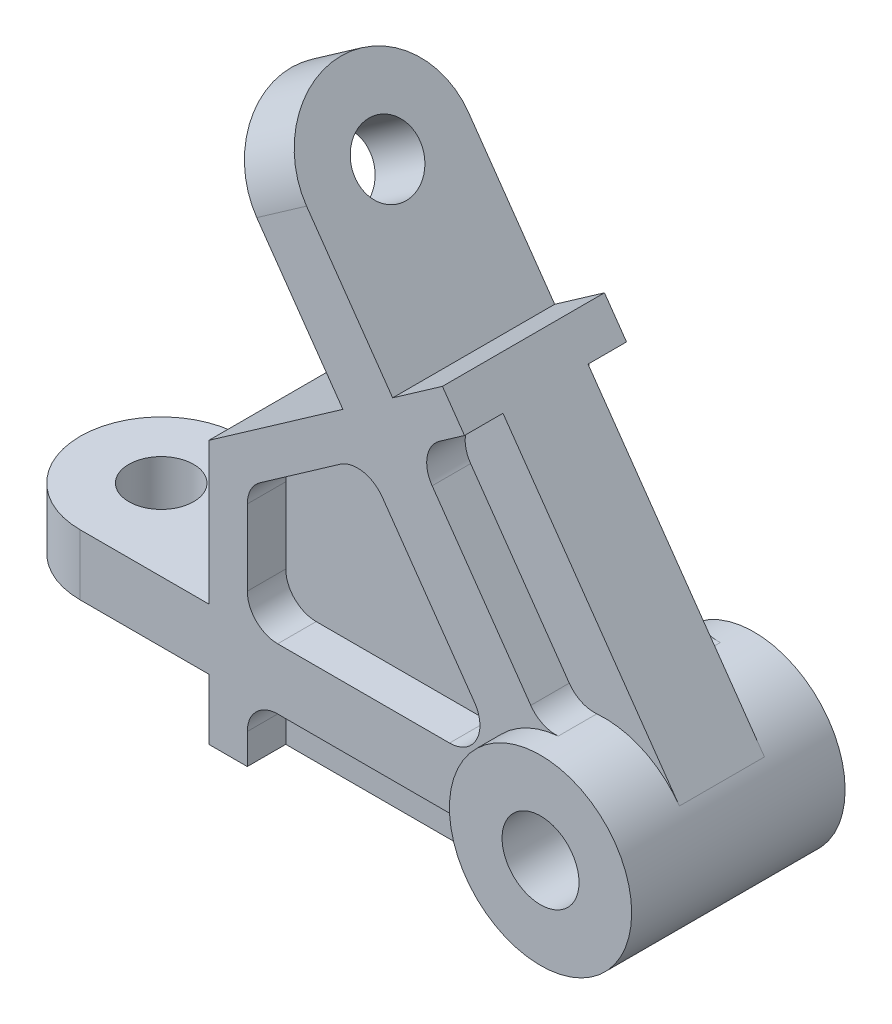
from build123d import *
from build123d.topology import SkipClean

# Parameters (mm, degrees)
BOSS_EXTRU_1_DEPTH      = 20
BOSS_EXTRU_2_DEPTH      = 26.35
BOSS_EXTRU_2_DEPTH_BACK = 26.35
ESQUISSE2_5_R           = 22.5
ESQUISSE2_5_R_2         = 9.5
BOSS_EXTRU_3_DEPTH      = 15
BOSS_EXTRU_4_DEPTH      = 15
ESQUISSE5_R             = 8
ENL_V_MAT_EXTRU_1_DEPTH = 189.886167776
ESQUISSE6_R             = 8
ENL_V_MAT_EXTRU_2_DEPTH = 192.871148908
ENL_V_START             = -9.5
ENL_V_MAT_EXTRU_3_DEPTH = 9.5


with BuildPart() as part:
    # Esquisse2 → Boss.-Extru.1 (new, symmetric)
    with BuildSketch(Plane.XY):
        with BuildLine():
            Line((-88.25, -22.5), (0, -22.5))
            ThreePointArc((0, -22.5), (-19.957743747, 10.389343798), (18.430920997, 12.905469818))
            Line((18.430920997, 12.905469818), (-30.570908371, 82.887334756))
            Line((-30.570908371, 82.887334756), (-42.858189035, 74.28368821))
            Line((-42.858189035, 74.28368821), (-64.119473121, 104.647948698))
            Line((-64.119473121, 104.647948698), (-76.406753785, 96.044302153))
            Line((-76.406753785, 96.044302153), (-55.1454697, 65.680041665))
            Line((-55.1454697, 65.680041665), (-88.25, 42.5))
            Line((-88.25, 42.5), (-88.25, 7.5))
            Line((-88.25, 7.5), (-120, 7.5))
            Line((-120, 7.5), (-120, -7.5))
            Line((-120, -7.5), (-88.25, -7.5))
            Line((-88.25, -7.5), (-88.25, -22.5))
        make_face()
    extrude(amount=BOSS_EXTRU_1_DEPTH, both=True)

    # Esquisse2<5> → Boss.-Extru.2 (add, two sides: drawn at the far end of the back side and taken through both)
    with BuildSketch(Plane.XY.offset(-BOSS_EXTRU_2_DEPTH_BACK)):
        Circle(ESQUISSE2_5_R)
        Circle(ESQUISSE2_5_R_2, mode=Mode.SUBTRACT)
    extrude(amount=BOSS_EXTRU_2_DEPTH + BOSS_EXTRU_2_DEPTH_BACK)

    # Esquisse3 → Boss.-Extru.3 (add)
    with BuildSketch(Plane.XZ.offset(7.5)):
        with BuildLine():
            Line((-120, 20), (-120, -20))
            ThreePointArc((-120, -20), (-140, 0), (-120, 20))
        make_face()
    extrude(amount=-BOSS_EXTRU_3_DEPTH)

    # Esquisse4 → Boss.-Extru.4 (add)
    with BuildSketch(Plane(origin=(6.143640332, 4.301823273, 0), x_dir=(0, 0, -1), z_dir=(0.819152044288993, 0.5735764363510446, 0))):
        with BuildLine():
            Line((-20, 122.5), (20, 122.5))
            ThreePointArc((20, 122.5), (0, 142.5), (-20, 122.5))
        make_face()
    extrude(amount=-BOSS_EXTRU_4_DEPTH)

    # Esquisse5 → Enlèv. mat.-Extru.1 (cut, through all)
    with BuildSketch(Plane(origin=(6.143640332, 4.301823273, 0), x_dir=(0, 0, -1), z_dir=(0.819152044288993, 0.5735764363510446, 0))):
        with Locations(Location((0, 122.5, 0), (0, 0, 90))):
            Circle(ESQUISSE5_R)
    extrude(amount=-ENL_V_MAT_EXTRU_1_DEPTH, mode=Mode.SUBTRACT)

    # Esquisse6 → Enlèv. mat.-Extru.2 (cut, through all)
    with BuildSketch(Plane.XZ.offset(7.5)):
        with Locations((-120, 0)):
            Circle(ESQUISSE6_R)
    extrude(amount=-ENL_V_MAT_EXTRU_2_DEPTH, mode=Mode.SUBTRACT)

    # Esquisse7 → Enlèv. mat.-Extru.3 (cut)
    with SkipClean():  # the faces are left unmerged after this step: merging them gives an invalid solid
        with BuildSketch(Plane.XY.offset(20).offset(ENL_V_START)):
            with BuildLine():
                Line((-31.265572558, 70.803567062), (-25.121932226, 75.105390335))
                Line((-25.121932226, 75.105390335), (18.430920997, 12.905469818))
                ThreePointArc((18.430920997, 12.905469818), (9.508910889, 20.391925208), (-1.961004212, 22.414380707))
                ThreePointArc((-1.961004212, 22.414380707), (-5.784309245, 23.08853254), (-8.758312615, 25.58401767))
                Line((-8.758312615, 25.58401767), (-33.107389617, 60.358103458))
                ThreePointArc((-33.107389617, 60.358103458), (-34.349807433, 65.962288063), (-31.265572558, 70.803567062))
            make_face()
            with BuildLine():
                Line((-75.551823273, 39.794000473), (-55.840133886, 53.596273972))
                ThreePointArc((-55.840133886, 53.596273972), (-50.235949281, 54.838691787), (-45.394670282, 51.754456912))
                Line((-45.394670282, 51.754456912), (-22.671091572, 19.301823273))
                ThreePointArc((-22.671091572, 19.301823273), (-22.162150656, 11.536885401), (-28.814731905, 7.5))
                Line((-28.814731905, 7.5), (-71.25, 7.5))
                ThreePointArc((-71.25, 7.5), (-76.553300859, 9.696699141), (-78.75, 15))
                Line((-78.75, 15), (-78.75, 33.650360141))
                ThreePointArc((-78.75, 33.650360141), (-77.902581249, 37.11347474), (-75.551823273, 39.794000473))
            make_face()
            with BuildLine():
                Line((-71.25, -7.5), (-25.980762114, -7.5))
                ThreePointArc((-25.980762114, -7.5), (-22.230762114, -8.504809472), (-19.485571585, -11.25))
                ThreePointArc((-19.485571585, -11.25), (-11.25, -19.485571585), (0, -22.5))
                Line((0, -22.5), (-78.75, -22.5))
                Line((-78.75, -22.5), (-78.75, -15))
                ThreePointArc((-78.75, -15), (-76.553300859, -9.696699141), (-71.25, -7.5))
            make_face()
        enl_v_mat_extru_3 = extrude(amount=ENL_V_MAT_EXTRU_3_DEPTH, mode=Mode.SUBTRACT)

    # Symétrie1: Enlèv. mat.-Extru.3 across plane
    add(enl_v_mat_extru_3.mirror(Plane.XY), mode=Mode.SUBTRACT)


solid = part.part
